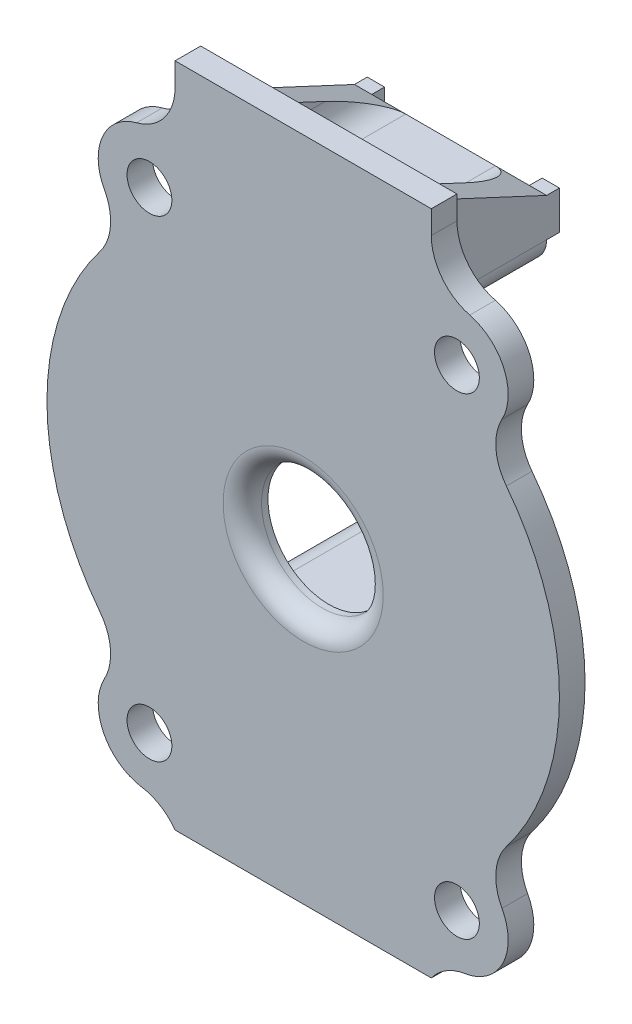
from build123d import *

# Parameters (mm, degrees)
CROQUIS1_R              = 1.75
CROQUIS1_R_2            = 4.75
SALIENTE_EXTRUIR1_DEPTH = 2
REDONDEO1_R             = 1.5
CROQUIS2_W              = 9.5
CROQUIS2_H              = 5
SALIENTE_EXTRUIR2_DEPTH = 7.5
CROQUIS3_R              = 0.9
CORTAR_EXTRUIR1_DEPTH   = 5
SALIENTE_EXTRUIR3_DEPTH = 2
REDONDEO2_R             = 2
REDONDEO3_R             = 2
CROQUIS5_W              = 1.35
CROQUIS5_H              = 3
SALIENTE_EXTRUIR4_DEPTH = 1


with BuildPart() as part:
    # Croquis1 → Saliente-Extruir1 (new body)
    with BuildSketch(Plane.XY):
        with BuildLine():
            Line((10, -24), (8, -24))
            Line((8, -24), (-8, -24))
            Line((-8, -24), (-10, -24))
            ThreePointArc((-10, -24), (-11.149780948, -22.933215846), (-12.621352058, -22.390534425))
            ThreePointArc((-12.621352058, -22.390534425), (-15.586404832, -20.210444436), (-15.515491876, -16.530865429))
            ThreePointArc((-15.515491876, -16.530865429), (-15.043435032, -14.307276752), (-15.859153127, -12.185534953))
            ThreePointArc((-15.859153127, -12.185534953), (-20, 0), (-15.859153127, 12.185534953))
            ThreePointArc((-15.859153127, 12.185534953), (-15.043435032, 14.307276752), (-15.515491876, 16.530865429))
            ThreePointArc((-15.515491876, 16.530865429), (-15.667833806, 20.035019732), (-13, 22.312072261))
            ThreePointArc((-13, 22.312072261), (-10.83772234, 23.735565864), (-10, 26.185055607))
            Line((-10, 26.185055607), (-10, 28))
            Line((-10, 28), (10, 28))
            Line((10, 28), (10, 26.185055607))
            ThreePointArc((10, 26.185055607), (10.83772234, 23.735565864), (13, 22.312072261))
            ThreePointArc((13, 22.312072261), (15.667833806, 20.035019732), (15.515491876, 16.530865429))
            ThreePointArc((15.515491876, 16.530865429), (15.043435032, 14.307276752), (15.859153127, 12.185534953))
            ThreePointArc((15.859153127, 12.185534953), (20, 0), (15.859153127, -12.185534953))
            ThreePointArc((15.859153127, -12.185534953), (15.043435032, -14.307276752), (15.515491876, -16.530865429))
            ThreePointArc((15.515491876, -16.530865429), (15.586404832, -20.210444436), (12.621352058, -22.390534425))
            ThreePointArc((12.621352058, -22.390534425), (11.149780948, -22.933215846), (10, -24))
        make_face()
        with Locations((-12, -18.439088915)):
            Circle(CROQUIS1_R, mode=Mode.SUBTRACT)
        with Locations((12, -18.439088915)):
            Circle(CROQUIS1_R, mode=Mode.SUBTRACT)
        with Locations((12, 18.439088915)):
            Circle(CROQUIS1_R, mode=Mode.SUBTRACT)
        with Locations((-12, 18.439088915)):
            Circle(CROQUIS1_R, mode=Mode.SUBTRACT)
        Circle(CROQUIS1_R_2, mode=Mode.SUBTRACT)
    extrude(amount=SALIENTE_EXTRUIR1_DEPTH)

    # Redondeo1
    redondeo1_edges = [part.edges().sort_by_distance(p)[0] for p in [
        (-4.75, 0, 2),
    ]]
    fillet(redondeo1_edges, radius=REDONDEO1_R)

    # Croquis2 → Saliente-Extruir2 (add, symmetric)
    with BuildSketch(Plane(origin=(0, 0, 0), x_dir=(0, 0, -1), z_dir=(1, 0, 0))):
        with Locations((4.75, 19.4)):
            Rectangle(CROQUIS2_W, CROQUIS2_H)
        with Locations((4.75, -9.1)):
            Rectangle(CROQUIS2_W, CROQUIS2_H)
    extrude(amount=SALIENTE_EXTRUIR2_DEPTH, both=True)

    # Croquis3 → Cortar-Extruir1 (cut)
    with BuildSketch(Plane(origin=(0, 0, -9.5), x_dir=(-1, 0, 0), z_dir=(0, 0, -1))):
        with Locations((0, -8.75)):
            Circle(CROQUIS3_R)
        with Locations((0, 19.05)):
            Circle(CROQUIS3_R)
    extrude(amount=-CORTAR_EXTRUIR1_DEPTH, mode=Mode.SUBTRACT)

    # Croquis4 → Saliente-Extruir3 (add)
    with BuildSketch(Plane.ZY.offset(7.5)):
        Polygon((-9.5, -11.6), (0, -16.029922752), (0, -11.6), align=None)
        Polygon((-9.5, 21.9), (0, 21.9), (0, 26.329922752), align=None)
    saliente_extruir3 = extrude(amount=-SALIENTE_EXTRUIR3_DEPTH)

    # Simetría1: Saliente-Extruir3 across plane
    add(saliente_extruir3.mirror(Plane(origin=(0, 0, 0), x_dir=(0, 0, 1), z_dir=(1, 0, 0))))

    # Redondeo2
    redondeo2_edges = [part.edges().sort_by_distance(p)[0] for p in [
        (-5.5, -11.6, -4.75),
        (-5.5, 21.9, -4.75),
        (5.5, -11.6, -4.75),
        (5.5, 21.9, -4.75),
    ]]
    fillet(redondeo2_edges, radius=REDONDEO2_R)

    # Redondeo3
    redondeo3_edges = [part.edges().sort_by_distance(p)[0] for p in [
        (-7.5, 16.9, -4.75),
        (7.5, 16.9, -4.75),
        (-7.5, -6.6, -4.75),
        (7.5, -6.6, -4.75),
    ]]
    fillet(redondeo3_edges, radius=REDONDEO3_R)

    # Croquis5 → Saliente-Extruir4 (add)
    with BuildSketch(Plane(origin=(0, 0, -9.5), x_dir=(-1, 0, 0), z_dir=(0, 0, -1))):
        with Locations((-6.825, -10.1)):
            Rectangle(CROQUIS5_W, CROQUIS5_H)
        with Locations((6.825, -10.1)):
            Rectangle(CROQUIS5_W, CROQUIS5_H)
        with Locations((6.825, 20.4)):
            Rectangle(CROQUIS5_W, CROQUIS5_H)
        with Locations((-6.825, 20.4)):
            Rectangle(CROQUIS5_W, CROQUIS5_H)
    extrude(amount=SALIENTE_EXTRUIR4_DEPTH)


solid = part.part
